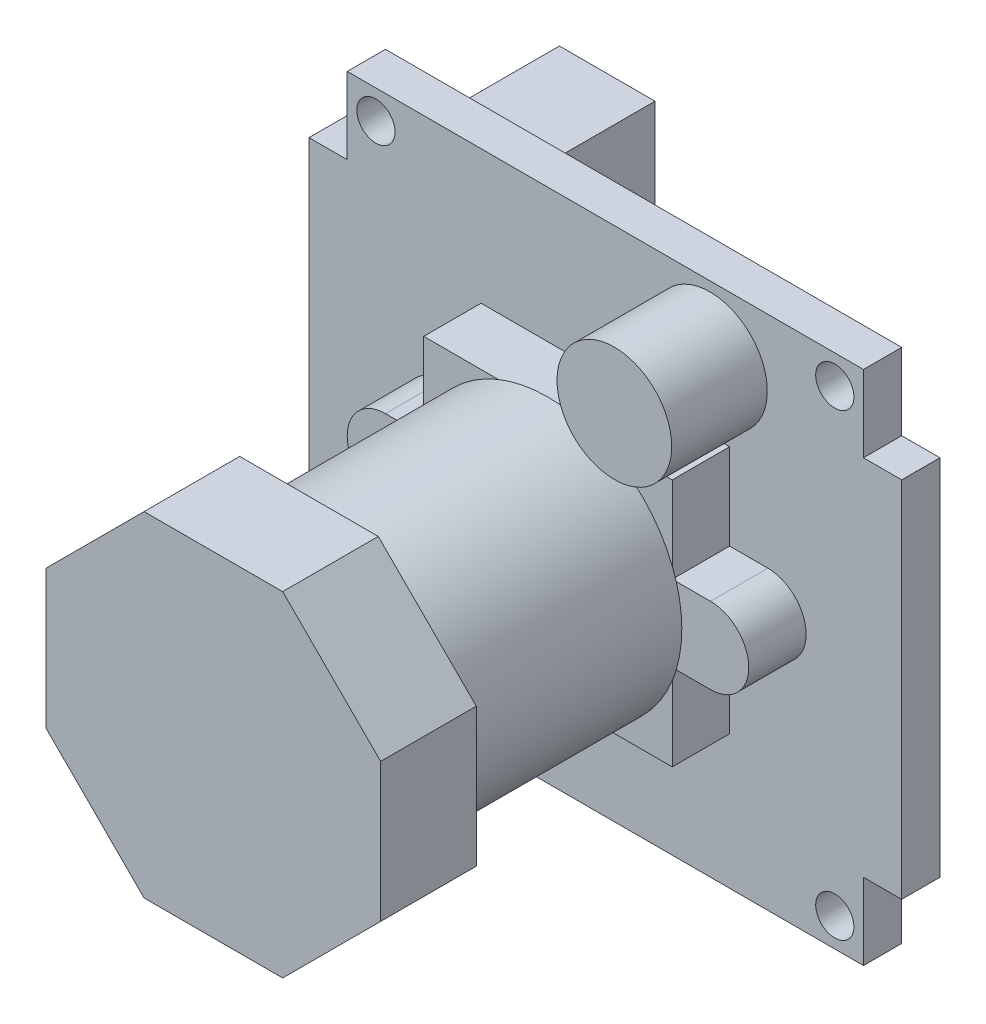
from build123d import *

# Parameters (mm, degrees)
SKETCH_1_W               = 31
SKETCH_1_H               = 27
EXTRUDE_426_DEPTH        = 2
SKETCH_2_W               = 2
SKETCH_2_H               = 4
CUT_EXTRUDE_591_DEPTH    = 21.651876428
SKETCH_3_R               = 1
CUT_EXTRUDE_937_DEPTH    = 21.651876428
MIRROR_2_COPY_1_SKETCH_W = 2
MIRROR_2_COPY_1_SKETCH_H = 4
MIRROR_2_COPY_1_DEPTH    = 21.651876428
MIRROR_2_COPY_2_SKETCH_R = 1
MIRROR_2_COPY_2_DEPTH    = 21.651876428
SKETCH_4_W               = 13
SKETCH_4_H               = 13
EXTRUDE_1335_DEPTH       = 3
EXTRUDE_1862_DEPTH       = 3
SKETCH_6_R               = 7
EXTRUDE_2122_DEPTH       = 12.5
EXTRUDE_2384_DEPTH       = 5
SKETCH_8_R               = 3
EXTRUDE_2930_DEPTH       = 5
SKETCH_9_W               = 5
SKETCH_9_H               = 10
USB_DEPTH                = 7
EXTRUDE_3576_DEPTH       = 4
EXTRUDE_3576_DEPTH_BACK  = 4
SKETCH_10_R              = 2


with BuildPart() as part:
    # Эскиз1 → Extrude 426 (new body)
    with BuildSketch(Plane.XY):
        Rectangle(SKETCH_1_W, SKETCH_1_H)
    extrude(amount=EXTRUDE_426_DEPTH)

    # Эскиз2 → Cut-Extrude 591 (cut, symmetric)
    with BuildSketch(Plane.XY.offset(2)):
        with Locations((-14.5, 11.5)):
            Rectangle(SKETCH_2_W, SKETCH_2_H)
    cut_extrude_591 = extrude(amount=CUT_EXTRUDE_591_DEPTH, both=True, mode=Mode.SUBTRACT)

    # Эскиз3 → Cut-Extrude 937 (cut, through all)
    with BuildSketch(Plane.XY.offset(2)):
        with Locations((-12, 12)):
            Circle(SKETCH_3_R)
    cut_extrude_937 = extrude(amount=-CUT_EXTRUDE_937_DEPTH, mode=Mode.SUBTRACT)

    # Зеркальное отражение1: Cut-Extrude 591, Cut-Extrude 937 across plane
    add(cut_extrude_591.mirror(Plane(origin=(0, 0, 0), x_dir=(0, 0, 1), z_dir=(1, 0, 0))), mode=Mode.SUBTRACT)
    add(cut_extrude_937.mirror(Plane(origin=(0, 0, 0), x_dir=(0, 0, 1), z_dir=(1, 0, 0))), mode=Mode.SUBTRACT)

    # Зеркальное отражение2: Cut-Extrude 591, Cut-Extrude 937 across plane
    add(cut_extrude_591.mirror(Plane.ZX), mode=Mode.SUBTRACT)
    add(cut_extrude_937.mirror(Plane.ZX), mode=Mode.SUBTRACT)

    # Зеркальное отражение2 copy 1 sketch → Зеркальное отражение2 copy 1 (cut, symmetric)
    with BuildSketch(Plane(origin=(0, 0, 2), x_dir=(-1, 0, 0), z_dir=(0, 0, 1))):
        with Locations((-14.5, 11.5)):
            Rectangle(MIRROR_2_COPY_1_SKETCH_W, MIRROR_2_COPY_1_SKETCH_H)
    extrude(amount=MIRROR_2_COPY_1_DEPTH, both=True, mode=Mode.SUBTRACT)

    # Зеркальное отражение2 copy 2 sketch → Зеркальное отражение2 copy 2 (cut, through all)
    with BuildSketch(Plane(origin=(0, 0, 2), x_dir=(-1, 0, 0), z_dir=(0, 0, 1))):
        with Locations((-12, 12)):
            Circle(MIRROR_2_COPY_2_SKETCH_R)
    extrude(amount=-MIRROR_2_COPY_2_DEPTH, mode=Mode.SUBTRACT)

    # Эскиз4 → Extrude 1335 (add)
    with BuildSketch(Plane.XY.offset(2)):
        Rectangle(SKETCH_4_W, SKETCH_4_H)
    extrude(amount=EXTRUDE_1335_DEPTH)

    # Эскиз5 → Extrude 1862 (add)
    with BuildSketch(Plane.XY.offset(2)):
        with BuildLine():
            Line((6.5, 2), (6.5, -2))
            Line((6.5, -2), (8.5, -2))
            ThreePointArc((8.5, -2), (10.5, 0), (8.5, 2))
            Line((8.5, 2), (6.5, 2))
        make_face()
        with BuildLine():
            Line((-6.5, 2), (-6.5, -2))
            Line((-6.5, -2), (-8.5, -2))
            ThreePointArc((-8.5, -2), (-10.5, 0), (-8.5, 2))
            Line((-8.5, 2), (-6.5, 2))
        make_face()
    extrude(amount=EXTRUDE_1862_DEPTH)

    # Эскиз6 → Extrude 2122 (add)
    with BuildSketch(Plane.XY.offset(5)):
        with Locations(Location((0, 0, 0), (0, 0, 163.398450401))):
            Circle(SKETCH_6_R)
    extrude(amount=EXTRUDE_2122_DEPTH)

    # Эскиз7 → Extrude 2384 (add)
    with BuildSketch(Plane.XY.offset(17.5)):
        Polygon((3.624368671, -8.75), (8.75, -3.624368671), (8.75, 3.624368671), (3.624368671, 8.75), (-3.624368671, 8.75), (-8.75, 3.624368671), (-8.75, -3.624368671), (-3.624368671, -8.75), align=None)
    extrude(amount=EXTRUDE_2384_DEPTH)

    # Эскиз8 → Extrude 2930 (add)
    with BuildSketch(Plane.XY.offset(2)):
        with Locations(Location((5.471283186, 10, 0), (0, 0, 180))):
            Circle(SKETCH_8_R)
    extrude(amount=EXTRUDE_2930_DEPTH)

    # Эскиз9 → usb (add)
    with BuildSketch(Plane(origin=(0, 0, 0), x_dir=(-1, 0, 0), z_dir=(0, 0, -1))):
        with Locations((8.9, 6.2)):
            Rectangle(SKETCH_9_W, SKETCH_9_H)
    extrude(amount=USB_DEPTH)


with BuildPart() as body_2:
    # Эскиз10 → Extrude 3576 (new, two sides: drawn at the far end of the back side and taken through both)
    with BuildSketch(Plane(origin=(0, 0, 0), x_dir=(0, 0, -1), z_dir=(1, 0, 0)).offset(-EXTRUDE_3576_DEPTH_BACK)):
        with Locations((2, -9.5)):
            Circle(SKETCH_10_R)
    extrude(amount=EXTRUDE_3576_DEPTH + EXTRUDE_3576_DEPTH_BACK)


solid = Compound([part.part, body_2.part])
